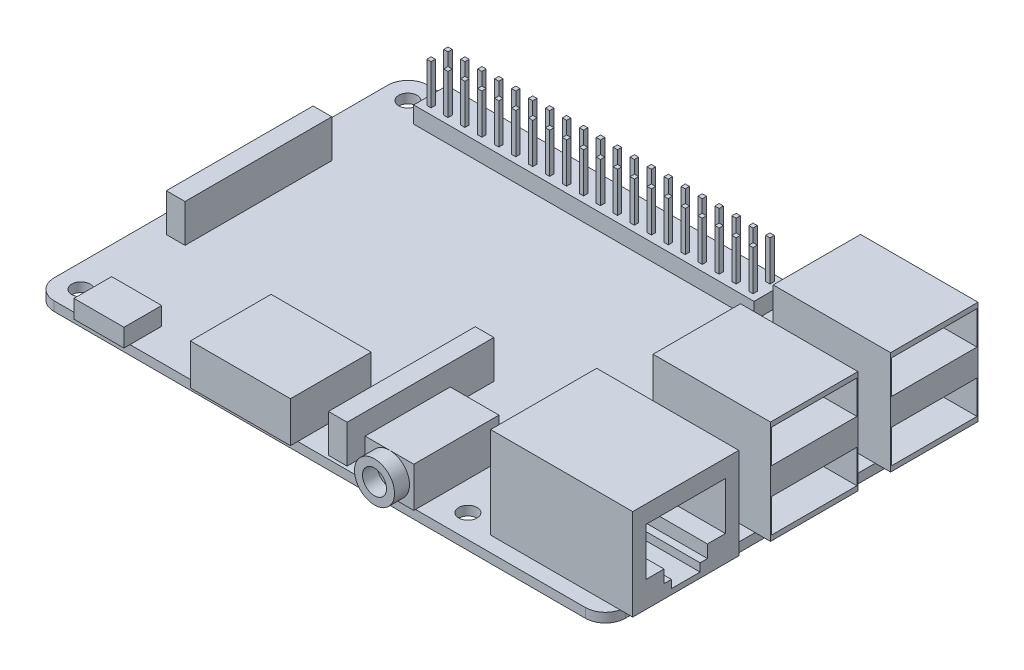
from build123d import *

# Parameters (mm, degrees)
BOSS_EXTRUDE1_DEPTH  = 1.4
SKETCH2_R            = 1.375
CUT_EXTRUDE1_DEPTH   = 52.164440777
SKETCH3_W            = 7.5
SKETCH3_H            = 5.65
BOSS_EXTRUDE2_DEPTH  = 2.7
SKETCH4_W            = 15
SKETCH4_H            = 12.1
BOSS_EXTRUDE3_DEPTH  = 6.1
SKETCH5_W            = 2.8
SKETCH5_H            = 22
BOSS_EXTRUDE4_DEPTH  = 5.7
SKETCH6_W            = 7.3
SKETCH6_H            = 12.5
BOSS_EXTRUDE5_DEPTH  = 6
SKETCH7_R            = 3
BOSS_EXTRUDE6_DEPTH  = 2.5
SKETCH8_W            = 21.3
SKETCH8_H            = 15.9
BOSS_EXTRUDE7_DEPTH  = 13.7
SKETCH9_R            = 1.8
CUT_EXTRUDE3_DEPTH   = 13
CUT_EXTRUDE4_DEPTH   = 9.7
SKETCH11_W           = 17.6
SKETCH11_H           = 13.1
BOSS_EXTRUDE8_DEPTH  = 15.5
SKETCH12_W           = 12.8
SKETCH12_H           = 5
CUT_EXTRUDE5_DEPTH   = 9
SKETCH13_W           = 2.8
SKETCH13_H           = 22
BOSS_EXTRUDE9_DEPTH  = 5.7
SKETCH14_W           = 51
SKETCH14_H           = 5
BOSS_EXTRUDE10_DEPTH = 2.5
SKETCH15_W           = 0.64
SKETCH15_H           = 0.64
BOSS_EXTRUDE11_DEPTH = 6
BOSS_EXTRUDE12_DEPTH = 0.253028977


with BuildPart() as part:
    # Sketch1 → Boss-Extrude1 (new body)
    with BuildSketch(Plane(origin=(0, 0, 0), x_dir=(1, 0, 0), z_dir=(0, 1, 0))):
        with BuildLine():
            Line((-39.8, -28), (39.8, -28))
            ThreePointArc((39.8, -28), (41.921320344, -27.121320344), (42.8, -25))
            Line((42.8, -25), (42.8, 25))
            ThreePointArc((42.8, 25), (41.921320344, 27.121320344), (39.8, 28))
            Line((39.8, 28), (-39.8, 28))
            ThreePointArc((-39.8, 28), (-41.921320344, 27.121320344), (-42.8, 25))
            Line((-42.8, 25), (-42.8, -25))
            ThreePointArc((-42.8, -25), (-41.921320344, -27.121320344), (-39.8, -28))
        make_face()
    extrude(amount=BOSS_EXTRUDE1_DEPTH)

    # Sketch2 → Cut-Extrude1 (cut, through all)
    with BuildSketch(Plane(origin=(0, 1.4, 0), x_dir=(1, 0, 0), z_dir=(0, 1, 0))):
        with Locations(Location((-39.3, 24.5, 0), (0, 0, 270))):
            Circle(SKETCH2_R)
        with Locations(Location((-39.3, -24.5, 0), (0, 0, 90))):
            Circle(SKETCH2_R)
        with Locations(Location((18.7, 24.5, 0), (0, 0, 270))):
            Circle(SKETCH2_R)
        with Locations(Location((18.7, -24.5, 0), (0, 0, 90))):
            Circle(SKETCH2_R)
    extrude(amount=-CUT_EXTRUDE1_DEPTH, mode=Mode.SUBTRACT)

    # Sketch3 → Boss-Extrude2 (add)
    with BuildSketch(Plane(origin=(0, 1.4, 0), x_dir=(1, 0, 0), z_dir=(0, 1, 0))):
        with Locations((-32.2, -26.075)):
            Rectangle(SKETCH3_W, SKETCH3_H)
    extrude(amount=BOSS_EXTRUDE2_DEPTH)

    # Sketch4 → Boss-Extrude3 (add)
    with BuildSketch(Plane(origin=(0, 1.4, 0), x_dir=(1, 0, 0), z_dir=(0, 1, 0))):
        with Locations((-10.8, -23.05)):
            Rectangle(SKETCH4_W, SKETCH4_H)
    extrude(amount=BOSS_EXTRUDE3_DEPTH)

    # Sketch5 → Boss-Extrude4 (add)
    with BuildSketch(Plane(origin=(0, 1.4, 0), x_dir=(1, 0, 0), z_dir=(0, 1, 0))):
        with Locations((2.2, -16.5)):
            Rectangle(SKETCH5_W, SKETCH5_H)
    extrude(amount=BOSS_EXTRUDE4_DEPTH)



with BuildPart() as body_2:
    # Sketch6 → Boss-Extrude5 (new body)
    with BuildSketch(Plane(origin=(0, 1.4, 0), x_dir=(1, 0, 0), z_dir=(0, 1, 0))):
        with Locations((10.7, -21.75)):
            Rectangle(SKETCH6_W, SKETCH6_H)
    extrude(amount=BOSS_EXTRUDE5_DEPTH)


with BuildPart() as part_1:
    add(part.part)

    add(body_2.part)  # Boss-Extrude6 merges body 2
    # Sketch7 → Boss-Extrude6 (add)
    with BuildSketch(Plane.XY.offset(28)):
        with Locations(Location((10.7, 4.4, 0), (0, 0, 90))):
            Circle(SKETCH7_R)
    extrude(amount=BOSS_EXTRUDE6_DEPTH)

    # Sketch9 → Cut-Extrude3 (cut)
    with BuildSketch(Plane.XY.offset(30.5)):
        with Locations((10.7, 4.4)):
            Circle(SKETCH9_R)
    extrude(amount=-CUT_EXTRUDE3_DEPTH, mode=Mode.SUBTRACT)

    # Sketch11 → Boss-Extrude8 (add)
    with BuildSketch(Plane(origin=(0, 1.4, 0), x_dir=(1, 0, 0), z_dir=(0, 1, 0))):
        with Locations((36.3, 1)):
            Rectangle(SKETCH11_W, SKETCH11_H)
        with Locations((36.3, 19)):
            Rectangle(SKETCH11_W, SKETCH11_H)
    extrude(amount=BOSS_EXTRUDE8_DEPTH)

    # Sketch12 → Cut-Extrude5 (cut)
    with BuildSketch(Plane(origin=(45.1, 0, 0), x_dir=(0, 0, -1), z_dir=(1, 0, 0))):
        with Locations((1, 13.65)):
            Rectangle(SKETCH12_W, SKETCH12_H)
        with Locations((1, 4.65)):
            Rectangle(SKETCH12_W, SKETCH12_H)
        with Locations((19, 4.65)):
            Rectangle(SKETCH12_W, SKETCH12_H)
        with Locations((19, 13.65)):
            Rectangle(SKETCH12_W, SKETCH12_H)
    extrude(amount=-CUT_EXTRUDE5_DEPTH, mode=Mode.SUBTRACT)

    # Sketch13 → Boss-Extrude9 (add)
    with BuildSketch(Plane(origin=(0, 1.4, 0), x_dir=(1, 0, 0), z_dir=(0, 1, 0))):
        with Locations((-38.6, 0)):
            Rectangle(SKETCH13_W, SKETCH13_H)
    extrude(amount=BOSS_EXTRUDE9_DEPTH)

    # Sketch14 → Boss-Extrude10 (add)
    with BuildSketch(Plane(origin=(0, 1.4, 0), x_dir=(1, 0, 0), z_dir=(0, 1, 0))):
        with Locations((-10.3, 24.374068286)):
            Rectangle(SKETCH14_W, SKETCH14_H)
    extrude(amount=BOSS_EXTRUDE10_DEPTH)

    # Sketch15 → Boss-Extrude11 (add)
    with BuildSketch(Plane(origin=(0, 3.9, 0), x_dir=(1, 0, 0), z_dir=(0, 1, 0))):
        with Locations((-31.89, 25.644068286)):
            Rectangle(SKETCH15_W, SKETCH15_H)
        with Locations((-34.43, 25.644068286)):
            Rectangle(SKETCH15_W, SKETCH15_H)
        with Locations((-29.35, 25.644068286)):
            Rectangle(SKETCH15_W, SKETCH15_H)
        with Locations((-26.81, 25.644068286)):
            Rectangle(SKETCH15_W, SKETCH15_H)
        with Locations((-24.27, 25.644068286)):
            Rectangle(SKETCH15_W, SKETCH15_H)
        with Locations((-21.73, 25.644068286)):
            Rectangle(SKETCH15_W, SKETCH15_H)
        with Locations((-19.19, 25.644068286)):
            Rectangle(SKETCH15_W, SKETCH15_H)
        with Locations((-16.65, 25.644068286)):
            Rectangle(SKETCH15_W, SKETCH15_H)
        with Locations((-14.11, 25.644068286)):
            Rectangle(SKETCH15_W, SKETCH15_H)
        with Locations((-11.57, 25.644068286)):
            Rectangle(SKETCH15_W, SKETCH15_H)
        with Locations((-11.57, 23.104068286)):
            Rectangle(SKETCH15_W, SKETCH15_H)
        with Locations((-14.11, 23.104068286)):
            Rectangle(SKETCH15_W, SKETCH15_H)
        with Locations((-16.65, 23.104068286)):
            Rectangle(SKETCH15_W, SKETCH15_H)
        with Locations((-19.19, 23.104068286)):
            Rectangle(SKETCH15_W, SKETCH15_H)
        with Locations((-21.73, 23.104068286)):
            Rectangle(SKETCH15_W, SKETCH15_H)
        with Locations((-24.27, 23.104068286)):
            Rectangle(SKETCH15_W, SKETCH15_H)
        with Locations((-26.81, 23.104068286)):
            Rectangle(SKETCH15_W, SKETCH15_H)
        with Locations((-29.35, 23.104068286)):
            Rectangle(SKETCH15_W, SKETCH15_H)
        with Locations((-31.89, 23.104068286)):
            Rectangle(SKETCH15_W, SKETCH15_H)
        with Locations((-34.43, 23.104068286)):
            Rectangle(SKETCH15_W, SKETCH15_H)
        with Locations((11.29, 23.104068286)):
            Rectangle(SKETCH15_W, SKETCH15_H)
        with Locations((13.83, 23.104068286)):
            Rectangle(SKETCH15_W, SKETCH15_H)
        with Locations((8.75, 23.104068286)):
            Rectangle(SKETCH15_W, SKETCH15_H)
        with Locations((6.21, 23.104068286)):
            Rectangle(SKETCH15_W, SKETCH15_H)
        with Locations((3.67, 23.104068286)):
            Rectangle(SKETCH15_W, SKETCH15_H)
        with Locations((1.13, 23.104068286)):
            Rectangle(SKETCH15_W, SKETCH15_H)
        with Locations((-1.41, 23.104068286)):
            Rectangle(SKETCH15_W, SKETCH15_H)
        with Locations((-3.95, 23.104068286)):
            Rectangle(SKETCH15_W, SKETCH15_H)
        with Locations((-6.49, 23.104068286)):
            Rectangle(SKETCH15_W, SKETCH15_H)
        with Locations((-9.03, 23.104068286)):
            Rectangle(SKETCH15_W, SKETCH15_H)
        with Locations((-9.03, 25.644068286)):
            Rectangle(SKETCH15_W, SKETCH15_H)
        with Locations((-6.49, 25.644068286)):
            Rectangle(SKETCH15_W, SKETCH15_H)
        with Locations((-3.95, 25.644068286)):
            Rectangle(SKETCH15_W, SKETCH15_H)
        with Locations((-1.41, 25.644068286)):
            Rectangle(SKETCH15_W, SKETCH15_H)
        with Locations((1.13, 25.644068286)):
            Rectangle(SKETCH15_W, SKETCH15_H)
        with Locations((3.67, 25.644068286)):
            Rectangle(SKETCH15_W, SKETCH15_H)
        with Locations((6.21, 25.644068286)):
            Rectangle(SKETCH15_W, SKETCH15_H)
        with Locations((8.75, 25.644068286)):
            Rectangle(SKETCH15_W, SKETCH15_H)
        with Locations((11.29, 25.644068286)):
            Rectangle(SKETCH15_W, SKETCH15_H)
        with Locations((13.83, 25.644068286)):
            Rectangle(SKETCH15_W, SKETCH15_H)
    extrude(amount=BOSS_EXTRUDE11_DEPTH)


with BuildPart() as body_2_2:
    # Sketch8 → Boss-Extrude7 (new body)
    with BuildSketch(Plane(origin=(0, 1.4, 0), x_dir=(1, 0, 0), z_dir=(0, 1, 0))):
        with Locations((33.95, -17.75)):
            Rectangle(SKETCH8_W, SKETCH8_H)
    extrude(amount=BOSS_EXTRUDE7_DEPTH)

    # Sketch10 → Cut-Extrude4 (cut)
    with BuildSketch(Plane(origin=(44.6, 0, 0), x_dir=(0, 0, -1), z_dir=(1, 0, 0))):
        Polygon((-15.6, 2.2), (-19.9, 2.2), (-19.9, 3.4), (-21, 3.4), (-21, 5.3), (-23.7, 5.3), (-23.7, 12.45), (-11.8, 12.45), (-11.8, 5.3), (-14.5, 5.3), (-14.5, 3.4), (-15.6, 3.4), align=None)
    extrude(amount=-CUT_EXTRUDE4_DEPTH, mode=Mode.SUBTRACT)


with BuildPart() as part_2:
    add(part_1.part)

    # Combine1: union body 2 2
    add(body_2_2.part)

    # Sketch17 → Boss-Extrude12 (add)
    with BuildSketch(Plane.XY.offset(28)):
        Polygon((14.35, 7.4), (14.35, 1.4), (7.05, 1.4), (7.05, 7.4), (10.7, 7.4), align=None)
    extrude(amount=BOSS_EXTRUDE12_DEPTH)


solid = part_2.part
